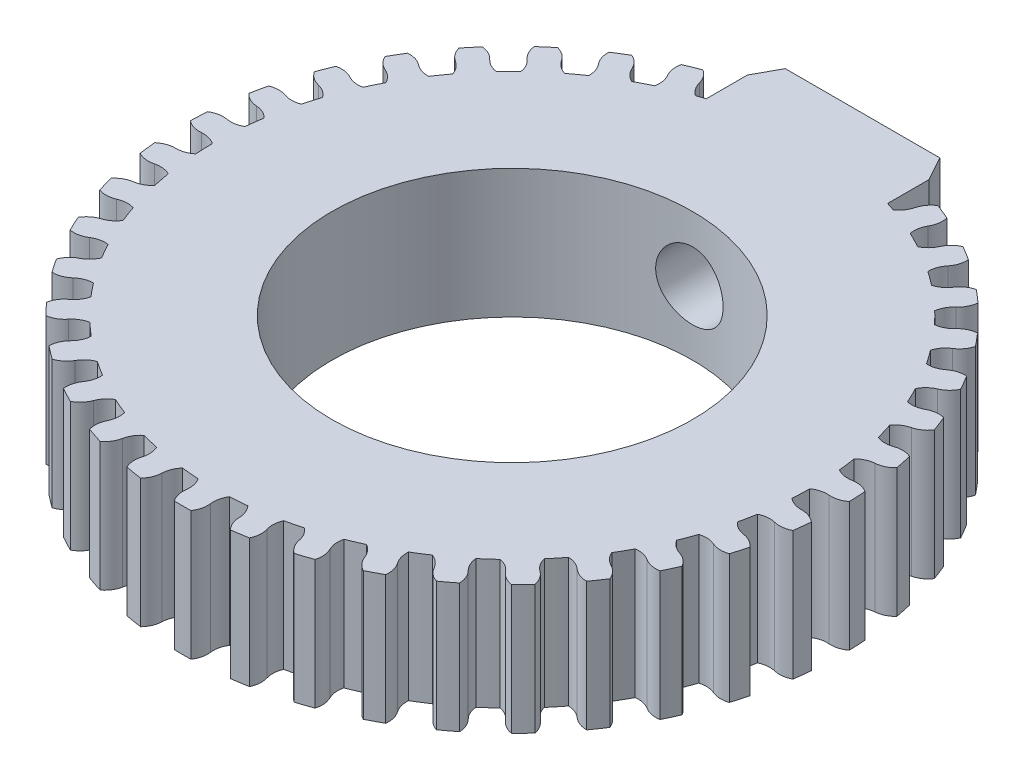
from build123d import *

# Parameters (mm, degrees)
SKETCH1_R           = 4.445
BOSS_EXTRUDE1_DEPTH = 3.175
SKETCH2_R           = 0.83185
CUT_EXTRUDE1_DEPTH  = 10.795
BOSS_EXTRUDE2_DEPTH = 3.175
CIRPATTERN1_COUNT   = 35
CIRPATTERN1_ANGLE   = 315.361356


with BuildPart() as part:
    # Sketch1 → Boss-Extrude1 (new body)
    with BuildSketch(Plane(origin=(0, 0, 0), x_dir=(1, 0, 0), z_dir=(0, 1, 0))):
        with BuildLine():
            Line((-2.2352, 7.018677722), (-2.2352, 8.034677722))
            Line((-2.2352, 8.034677722), (-1.905, 8.636))
            Line((-1.905, 8.636), (1.905, 8.636))
            Line((1.905, 8.636), (2.2352, 8.034677722))
            Line((2.2352, 8.034677722), (2.2352, 7.018677722))
            ThreePointArc((2.2352, 7.018677722), (0, -7.366), (-2.2352, 7.018677722))
        make_face()
        with Locations(Location((0, 0, 0), (0, 0, 270))):
            Circle(SKETCH1_R, mode=Mode.SUBTRACT)
    extrude(amount=BOSS_EXTRUDE1_DEPTH)

    # Sketch2 → Cut-Extrude1 (cut)
    with BuildSketch(Plane(origin=(0, 0, -8.636), x_dir=(-1, 0, 0), z_dir=(0, 0, -1))):
        with Locations((0, 1.5875)):
            Circle(SKETCH2_R)
    extrude(amount=-CUT_EXTRUDE1_DEPTH, mode=Mode.SUBTRACT)

    # Sketch3 → Boss-Extrude2 (add)
    with BuildSketch(Plane.XZ):
        with BuildLine():
            ThreePointArc((-3.27331591, -7.439743742), (-3.084547787, -7.51997001), (-2.89381543, -7.595407577))
            ThreePointArc((-2.89381543, -7.595407577), (-2.744867659, -7.453976173), (-2.657082234, -7.268282879))
            ThreePointArc((-2.657082234, -7.268282879), (-2.574713995, -7.090208594), (-2.435869937, -6.951582097))
            ThreePointArc((-2.435869937, -6.951582097), (-2.795371432, -6.814972821), (-3.147252938, -6.659786404))
            ThreePointArc((-3.147252938, -6.659786404), (-3.145746492, -6.855981991), (-3.212149675, -7.040604837))
            ThreePointArc((-3.212149675, -7.040604837), (-3.280046196, -7.234456179), (-3.27331591, -7.439743742))
        make_face()
    boss_extrude2 = extrude(amount=-BOSS_EXTRUDE2_DEPTH)

    # CirPattern1: Boss-Extrude2 ×35 about axis
    cirpattern1_axis = Axis((0, 0, 0), (0, 1, 0))
    for i in range(1, CIRPATTERN1_COUNT):
        add(boss_extrude2.rotate(cirpattern1_axis, i * CIRPATTERN1_ANGLE / (CIRPATTERN1_COUNT - 1)))


solid = part.part
